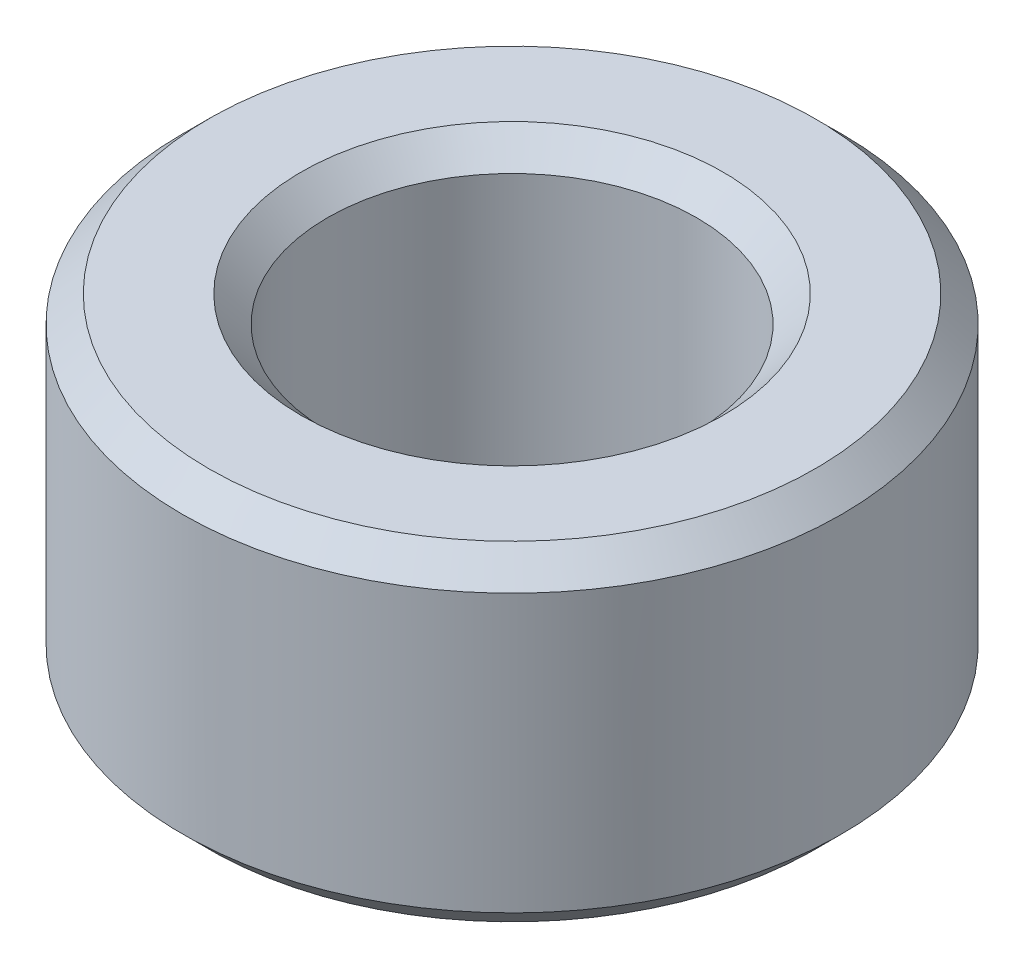
from build123d import *

# Parameters (mm, degrees)
SKETCH1_W     = 1.397
SKETCH1_H     = 3.175
CHAMFER1_SIZE = 0.254


with BuildPart() as part:
    # Sketch1 → Revolve1 (revolve)
    with BuildSketch(Plane.XY, mode=Mode.PRIVATE) as revolve1_sk:
        with Locations((2.4765, 0)):
            Rectangle(SKETCH1_W, SKETCH1_H)
    revolve(revolve1_sk.sketch.rotate(Axis((0, 0, 0), (0, 1, 0)), 90), axis=Axis((0, 0, 0), (0, 1, 0)))

    # Chamfer1
    chamfer1_edges = [part.edges().sort_by_distance(p)[0] for p in [
        (0, -1.5875, 1.778),
        (0, -1.5875, 3.175),
        (0, 1.5875, 3.175),
        (0, 1.5875, 1.778),
    ]]
    chamfer(chamfer1_edges, length=CHAMFER1_SIZE)


solid = part.part
